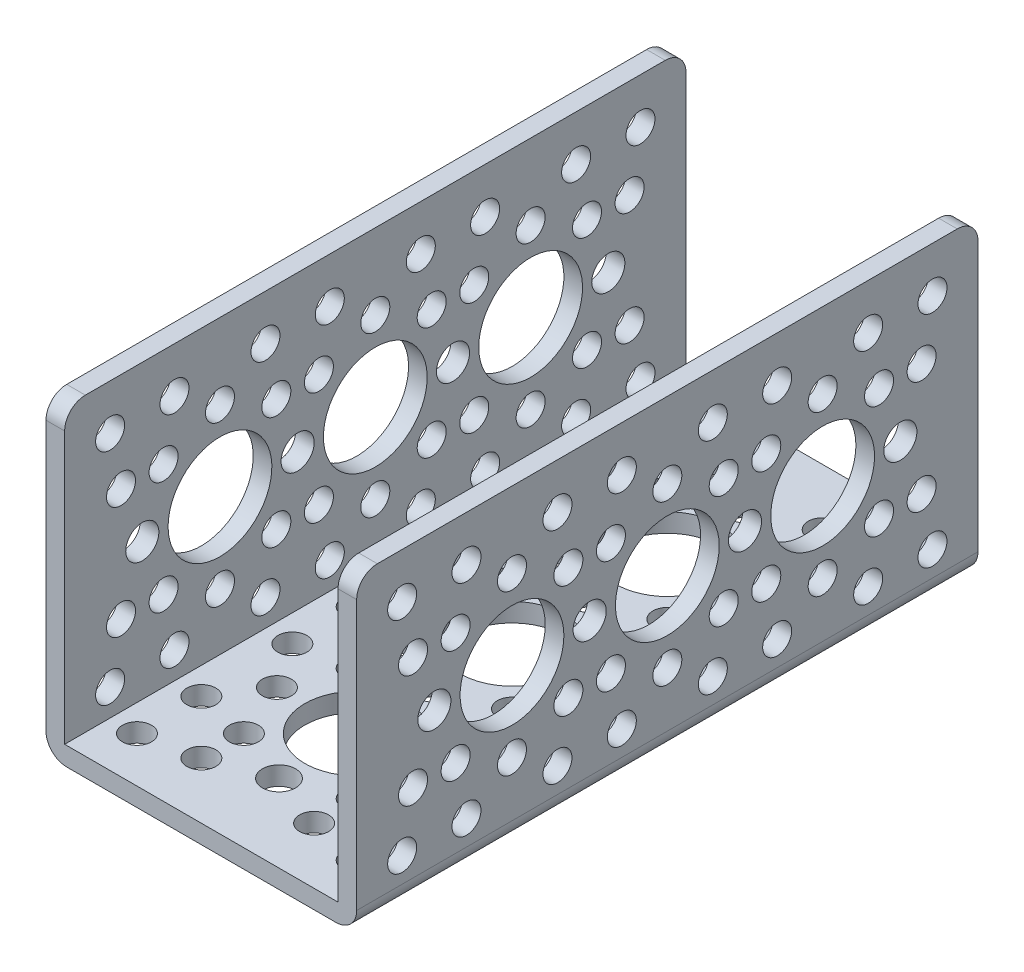
from build123d import *

# Parameters (mm, degrees)
SKETCH1_W                  = 38.1
SKETCH1_H                  = 76.2
BOSS_EXTRUDE1_DEPTH        = 38.1
SKETCH2_W                  = 33.528
SKETCH2_H                  = 35.814
CUT_EXTRUDE1_DEPTH         = 94.3255592
HOLE1_D                    = 12.7254
HOLE1_DEPTH                = 2.286
M3_CLEARANCE_HOLE1_D       = 3.556
M3_CLEARANCE_HOLE1_DEPTH   = 2.286
M3_5_CLEARANCE_HOLE1_D     = 4.064
M3_5_CLEARANCE_HOLE1_DEPTH = 2.286
HOLE2_D                    = 12.7254
HOLE2_DEPTH                = 38.1
M3_5_CLEARANCE_HOLE2_D     = 4.064
M3_5_CLEARANCE_HOLE2_DEPTH = 38.1
M3_CLEARANCE_HOLE2_D       = 3.556
M3_CLEARANCE_HOLE2_DEPTH   = 38.1
HOLE3_D                    = 12.7254
HOLE3_DEPTH                = 38.1
M3_CLEARANCE_HOLE3_D       = 3.556
M3_CLEARANCE_HOLE3_DEPTH   = 38.1
M3_5_CLEARANCE_HOLE3_D     = 4.064
M3_5_CLEARANCE_HOLE3_DEPTH = 38.1
FILLET1_R                  = 2.54


with BuildPart() as part:
    # Sketch1 → Boss-Extrude1 (new body)
    with BuildSketch(Plane.XZ):
        with Locations((19.05, 38.1)):
            Rectangle(SKETCH1_W, SKETCH1_H)
    extrude(amount=-BOSS_EXTRUDE1_DEPTH)

    # Sketch2 → Cut-Extrude1 (cut, through all)
    with BuildSketch(Plane.XY.offset(76.2)):
        with Locations((19.05, 20.193)):
            Rectangle(SKETCH2_W, SKETCH2_H)
    extrude(amount=-CUT_EXTRUDE1_DEPTH, mode=Mode.SUBTRACT)

    # Hole1
    with Locations(Plane(origin=(38.1, 0, 0), x_dir=(0, 0, -1), z_dir=(1, 0, 0))):
        with Locations((-38.1, 19.05), (-19.05, 19.05), (-57.15, 19.05)):
            Hole(HOLE1_D / 2, depth=HOLE1_DEPTH)

    # M3 Clearance Hole1
    with Locations(Plane(origin=(38.1, 0, 0), x_dir=(0, 0, -1), z_dir=(1, 0, 0))):
        with Locations((-62.729615818, 5.579615818), (-69.285202787, 12.135202787), (-62.729615818, 32.520384182), (-69.285202787, 25.964797213), (-13.470384182, 5.579615818), (-6.914797213, 12.135202787), (-13.470384182, 32.520384182), (-6.914797213, 25.964797213), (-43.679615818, 5.579615818), (-24.629615818, 5.579615818), (-43.679615818, 32.520384182), (-24.629615818, 32.520384182), (-70.620384182, 5.579615818), (-70.620384182, 32.520384182), (-51.570384182, 5.579615818), (-51.570384182, 32.520384182), (-50.235202787, 12.135202787), (-57.15, 9.271), (-64.064797213, 12.135202787), (-64.064797213, 25.964797213), (-57.15, 28.829), (-31.185202787, 12.135202787), (-38.1, 9.271), (-45.014797213, 12.135202787), (-45.014797213, 25.964797213), (-38.1, 28.829), (-50.235202787, 25.964797213), (-31.185202787, 25.964797213), (-32.520384182, 5.579615818), (-32.520384182, 32.520384182), (-5.579615818, 5.579615818), (-5.579615818, 32.520384182), (-12.135202787, 12.135202787), (-19.05, 9.271), (-25.964797213, 12.135202787), (-25.964797213, 25.964797213), (-19.05, 28.829), (-12.135202787, 25.964797213)):
            Hole(M3_CLEARANCE_HOLE1_D / 2, depth=M3_CLEARANCE_HOLE1_DEPTH)

    # M3.5 Clearance Hole1
    with Locations(Plane(origin=(38.1, 0, 0), x_dir=(0, 0, -1), z_dir=(1, 0, 0))):
        with Locations((-66.675, 19.05), (-47.625, 19.05), (-28.575, 19.05), (-9.525, 19.05)):
            Hole(M3_5_CLEARANCE_HOLE1_D / 2, depth=M3_5_CLEARANCE_HOLE1_DEPTH)

    # Hole2
    with Locations(Plane(origin=(0, 0, 0), x_dir=(-1, 0, 0), z_dir=(0, -1, 0))):
        with Locations((-19.05, -57.15), (-19.05, -38.1), (-19.05, -19.05)):
            Hole(HOLE2_D / 2, depth=HOLE2_DEPTH)

    # M3.5 Clearance Hole2
    with Locations(Plane(origin=(0, 0, 0), x_dir=(-1, 0, 0), z_dir=(0, -1, 0))):
        with Locations((-19.05, -66.675), (-19.05, -47.625), (-19.05, -28.575), (-19.05, -9.525)):
            Hole(M3_5_CLEARANCE_HOLE2_D / 2, depth=M3_5_CLEARANCE_HOLE2_DEPTH)

    # M3 Clearance Hole2
    with Locations(Plane(origin=(0, 0, 0), x_dir=(-1, 0, 0), z_dir=(0, -1, 0))):
        with Locations((-5.579615818, -70.620384182), (-5.579615818, -62.729615818), (-12.135202787, -69.285202787), (-32.520384182, -70.620384182), (-32.520384182, -62.729615818), (-25.964797213, -69.285202787), (-5.579615818, -51.570384182), (-5.579615818, -43.679615818), (-32.520384182, -51.570384182), (-32.520384182, -43.679615818), (-12.135202787, -50.235202787), (-9.271, -57.15), (-12.135202787, -64.064797213), (-25.964797213, -64.064797213), (-28.829, -57.15), (-25.964797213, -50.235202787), (-9.271, -38.1), (-12.135202787, -45.014797213), (-25.964797213, -45.014797213), (-28.829, -38.1), (-5.579615818, -32.520384182), (-5.579615818, -24.629615818), (-12.135202787, -31.185202787), (-32.520384182, -32.520384182), (-32.520384182, -24.629615818), (-25.964797213, -31.185202787), (-5.579615818, -5.579615818), (-5.579615818, -13.470384182), (-12.135202787, -6.914797213), (-32.520384182, -5.579615818), (-32.520384182, -13.470384182), (-25.964797213, -6.914797213), (-12.135202787, -12.135202787), (-9.271, -19.05), (-12.135202787, -25.964797213), (-25.964797213, -25.964797213), (-28.829, -19.05), (-25.964797213, -12.135202787)):
            Hole(M3_CLEARANCE_HOLE2_D / 2, depth=M3_CLEARANCE_HOLE2_DEPTH)

    # Hole3
    with Locations(Plane.ZY):
        with Locations((38.1, 19.05), (19.05, 19.05), (57.15, 19.05)):
            Hole(HOLE3_D / 2, depth=HOLE3_DEPTH)

    # M3 Clearance Hole3
    with Locations(Plane.ZY):
        with Locations((62.729615818, 5.579615818), (69.285202787, 12.135202787), (62.729615818, 32.520384182), (69.285202787, 25.964797213), (13.470384182, 5.579615818), (6.914797213, 12.135202787), (13.470384182, 32.520384182), (6.914797213, 25.964797213), (43.679615818, 5.579615818), (24.629615818, 5.579615818), (43.679615818, 32.520384182), (24.629615818, 32.520384182), (70.620384182, 5.579615818), (70.620384182, 32.520384182), (51.570384182, 5.579615818), (51.570384182, 32.520384182), (50.235202787, 12.135202787), (57.15, 9.271), (64.064797213, 12.135202787), (64.064797213, 25.964797213), (57.15, 28.829), (31.185202787, 12.135202787), (38.1, 9.271), (45.014797213, 12.135202787), (45.014797213, 25.964797213), (38.1, 28.829), (50.235202787, 25.964797213), (31.185202787, 25.964797213), (32.520384182, 5.579615818), (32.520384182, 32.520384182), (5.579615818, 5.579615818), (5.579615818, 32.520384182), (12.135202787, 12.135202787), (19.05, 9.271), (25.964797213, 12.135202787), (25.964797213, 25.964797213), (19.05, 28.829), (12.135202787, 25.964797213)):
            Hole(M3_CLEARANCE_HOLE3_D / 2, depth=M3_CLEARANCE_HOLE3_DEPTH)

    # M3.5 Clearance Hole3
    with Locations(Plane.ZY):
        with Locations((66.675, 19.05), (47.625, 19.05), (28.575, 19.05), (9.525, 19.05)):
            Hole(M3_5_CLEARANCE_HOLE3_D / 2, depth=M3_5_CLEARANCE_HOLE3_DEPTH)

    # Fillet1
    fillet1_edges = [part.edges().sort_by_distance(p)[0] for p in [
        (1.143, 38.1, 0),
        (36.957, 38.1, 0),
        (1.143, 38.1, 76.2),
        (0, 0, 38.1),
        (38.1, 0, 38.1),
        (36.957, 38.1, 76.2),
    ]]
    fillet(fillet1_edges, radius=FILLET1_R)


solid = part.part
